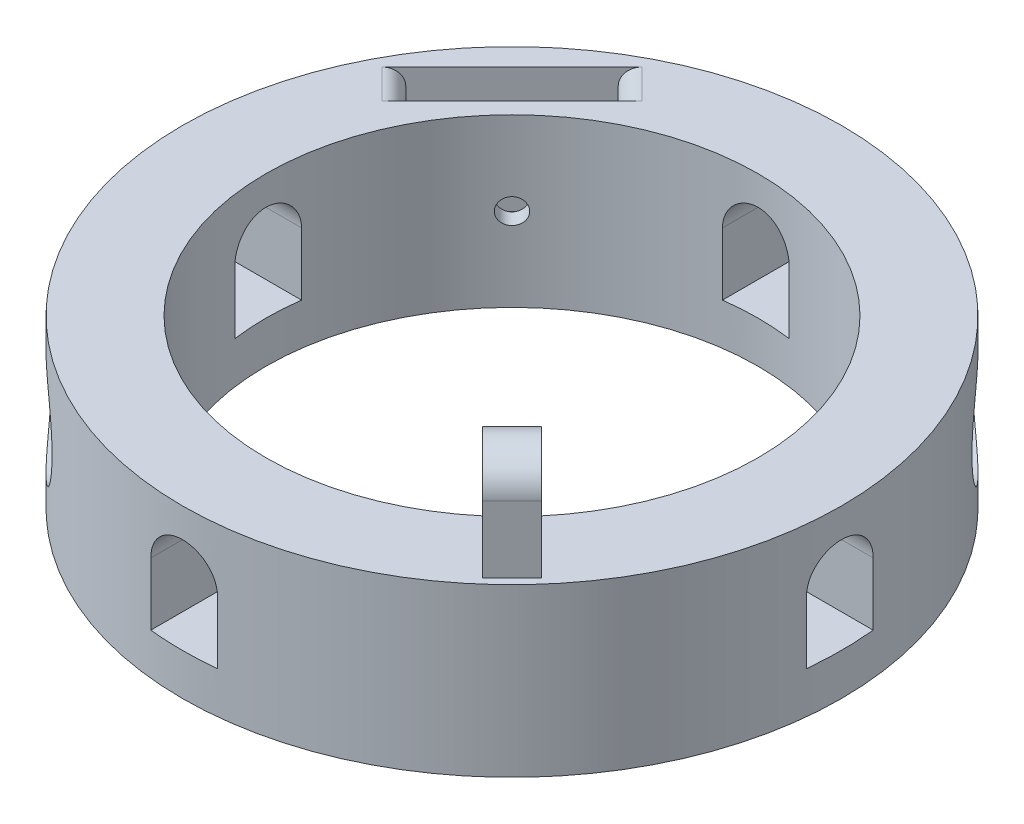
from build123d import *

# Parameters (mm, degrees)
SKETCH1_R           = 39.5
SKETCH1_R_2         = 29.5
BOSS_EXTRUDE1_DEPTH = 20
CUT_EXTRUDE1_DEPTH  = 60.333801496
CUT_EXTRUDE2_DEPTH  = 60.333801663
CUT_EXTRUDE3_REACH  = 61.334
SKETCH4_R           = 3.175
CUT_EXTRUDE4_REACH  = 61.334
SKETCH4_2_R         = 3.175
BOSS_EXTRUDE2_DEPTH = 13
CUT_EXTRUDE7_REACH  = 69.045
CUT_EXTRUDE8_REACH  = 68.559
SKETCH7_R           = 1
SKETCH8_R           = 6.35
CUT_EXTRUDE9_DEPTH  = 1
CUT_EXTRUDE11_DEPTH = 15
SKETCH10_R          = 1.5
CUT_EXTRUDE12_DEPTH = 40
FILLET1_R           = 2
FILLET2_R           = 2


with BuildPart() as part:
    # Sketch1 → Boss-Extrude1 (new body)
    with BuildSketch(Plane(origin=(0, 0, 0), x_dir=(1, 0, 0), z_dir=(0, 1, 0))):
        Circle(SKETCH1_R)
        Circle(SKETCH1_R_2, mode=Mode.SUBTRACT)
    extrude(amount=BOSS_EXTRUDE1_DEPTH)

    # Sketch2 → Cut-Extrude1 (cut, through all)
    with BuildSketch(Plane(origin=(0, 0, 0), x_dir=(0, 0, -1), z_dir=(1, 0, 0))):
        with BuildLine():
            Line((4, 5), (-4, 5))
            Line((-4, 5), (-4, 12.5))
            ThreePointArc((-4, 12.5), (0, 16.5), (4, 12.5))
            Line((4, 12.5), (4, 5))
        make_face()
    cut_extrude1 = extrude(amount=-CUT_EXTRUDE1_DEPTH, mode=Mode.SUBTRACT)

    # Sketch2<2> → Cut-Extrude2 (cut, through all)
    with BuildSketch(Plane(origin=(0, 0, 0), x_dir=(0, 0, -1), z_dir=(1, 0, 0))):
        with BuildLine():
            Line((4, 5), (-4, 5))
            Line((-4, 5), (-4, 12.5))
            ThreePointArc((-4, 12.5), (0, 16.5), (4, 12.5))
            Line((4, 12.5), (4, 5))
        make_face()
    cut_extrude2 = extrude(amount=CUT_EXTRUDE2_DEPTH, mode=Mode.SUBTRACT)

    # Mirror1: Cut-Extrude1, Cut-Extrude2 across plane
    add(cut_extrude1.mirror(Plane(origin=(0, 0, 0), x_dir=(0.7071067811865478, 0, 0.7071067811865472), z_dir=(0.7071067811865475, 0, -0.7071067811865477))), mode=Mode.SUBTRACT)
    add(cut_extrude2.mirror(Plane(origin=(0, 0, 0), x_dir=(0.7071067811865478, 0, 0.7071067811865472), z_dir=(0.7071067811865475, 0, -0.7071067811865477))), mode=Mode.SUBTRACT)

    # Sketch4 → Cut-Extrude3 (cut, up to next)
    with BuildSketch(Plane(origin=(0, 0, 0), x_dir=(-0.7071067811865477, 0, -0.7071067811865475), z_dir=(0.7071067811865475, 0, -0.7071067811865477)), mode=Mode.PRIVATE) as cut_extrude3_sk1:
        with Locations((0, 10)):
            Circle(SKETCH4_R)
    cut_extrude3_tool1 = extrude(cut_extrude3_sk1.sketch, amount=-CUT_EXTRUDE3_REACH, mode=Mode.PRIVATE) & part.part
    add(cut_extrude3_tool1.solids().sort_by_distance((0, 10, 0))[0], mode=Mode.SUBTRACT)

    # Sketch4<2> → Cut-Extrude4 (cut, up to next)
    with BuildSketch(Plane(origin=(0, 0, 0), x_dir=(-0.7071067811865477, 0, -0.7071067811865475), z_dir=(0.7071067811865475, 0, -0.7071067811865477)), mode=Mode.PRIVATE) as cut_extrude4_sk1:
        with Locations((0, 10)):
            Circle(SKETCH4_2_R)
    cut_extrude4_tool1 = extrude(cut_extrude4_sk1.sketch, amount=CUT_EXTRUDE4_REACH, mode=Mode.PRIVATE) & part.part
    add(cut_extrude4_tool1.solids().sort_by_distance((0, 10, 0))[0], mode=Mode.SUBTRACT)

    # Sketch5 → Boss-Extrude2 (add)
    with BuildSketch(Plane(origin=(0, 20, 0), x_dir=(1, 0, 0), z_dir=(0, 1, 0))):
        Polygon((25.455844123, -28.991378029), (28.991378029, -25.455844123), (23.334523779, -19.798989873), (19.798989873, -23.334523779), align=None)
    extrude(amount=BOSS_EXTRUDE2_DEPTH)

    # Sketch6 → Cut-Extrude7 (cut, up to next)
    with BuildSketch(Plane(origin=(1.767766953, 0, -1.767766953), x_dir=(-0.7071067811865475, 0, -0.7071067811865477), z_dir=(0.7071067811865477, 0, -0.7071067811865475)), mode=Mode.PRIVATE) as cut_extrude7_sk1:
        with BuildLine():
            Line((-38.5, 28), (-38.5, 33))
            Line((-38.5, 33), (-30.5, 33))
            Line((-30.5, 33), (-30.5, 28))
            ThreePointArc((-30.5, 28), (-34.5, 32), (-38.5, 28))
        make_face()
    cut_extrude7_tool1 = extrude(cut_extrude7_sk1.sketch, amount=-CUT_EXTRUDE7_REACH, mode=Mode.PRIVATE) & part.part
    add(cut_extrude7_tool1.solids().sort_by_distance((26.162951, 32.09434, 22.627417))[0], mode=Mode.SUBTRACT)

    # Sketch7 → Cut-Extrude8 (cut, up to next)
    with BuildSketch(Plane(origin=(1.767766953, 0, -1.767766953), x_dir=(-0.7071067811865475, 0, -0.7071067811865477), z_dir=(0.7071067811865477, 0, -0.7071067811865475)), mode=Mode.PRIVATE) as cut_extrude8_sk1:
        with Locations((-34.5, 28)):
            Circle(SKETCH7_R)
    cut_extrude8_tool1 = extrude(cut_extrude8_sk1.sketch, amount=-CUT_EXTRUDE8_REACH, mode=Mode.PRIVATE) & part.part
    add(cut_extrude8_tool1.solids().sort_by_distance((26.162951, 28, 22.627417))[0], mode=Mode.SUBTRACT)

    # Sketch8 → Cut-Extrude9 (cut)
    with BuildSketch(Plane(origin=(27.930717857, 0, -27.930717857), x_dir=(-0.7071067811865477, 0, -0.7071067811865475), z_dir=(0.7071067811865475, 0, -0.7071067811865477))):
        with Locations((0, 10)):
            Circle(SKETCH8_R)
    cut_extrude9 = extrude(amount=-CUT_EXTRUDE9_DEPTH, mode=Mode.SUBTRACT)

    # Mirror3: Cut-Extrude9 across plane
    add(cut_extrude9.mirror(Plane(origin=(0, 0, 0), x_dir=(0.7071067811865478, 0, 0.7071067811865472), z_dir=(0.7071067811865475, 0, -0.7071067811865477))), mode=Mode.SUBTRACT)

    # Sketch9 → Cut-Extrude11 (cut)
    with BuildSketch(Plane(origin=(0, 20, 0), x_dir=(1, 0, 0), z_dir=(0, 1, 0))):
        Polygon((-19.445436483, 32.173358544), (-32.173358544, 19.445436483), (-28.637824638, 15.909902577), (-15.909902577, 28.637824638), align=None)
    extrude(amount=-CUT_EXTRUDE11_DEPTH, mode=Mode.SUBTRACT)

    # Sketch10 → Cut-Extrude12 (cut)
    with BuildSketch(Plane(origin=(0, 0, 0), x_dir=(0.7071067811865477, 0, -0.7071067811865475), z_dir=(0.7071067811865475, 0, 0.7071067811865477))):
        with Locations((0, 10)):
            Circle(SKETCH10_R)
    extrude(amount=-CUT_EXTRUDE12_DEPTH, mode=Mode.SUBTRACT)

    # Fillet1
    fillet1_edges = [part.edges().sort_by_distance(p)[0] for p in [
        (-17.67766953, 20, -30.405591591),
    ]]
    fillet(fillet1_edges, radius=FILLET1_R)

    # Fillet2
    fillet2_edges = [part.edges().sort_by_distance(p)[0] for p in [
        (-30.405591591, 20, -17.67766953),
    ]]
    fillet(fillet2_edges, radius=FILLET2_R)


solid = part.part
